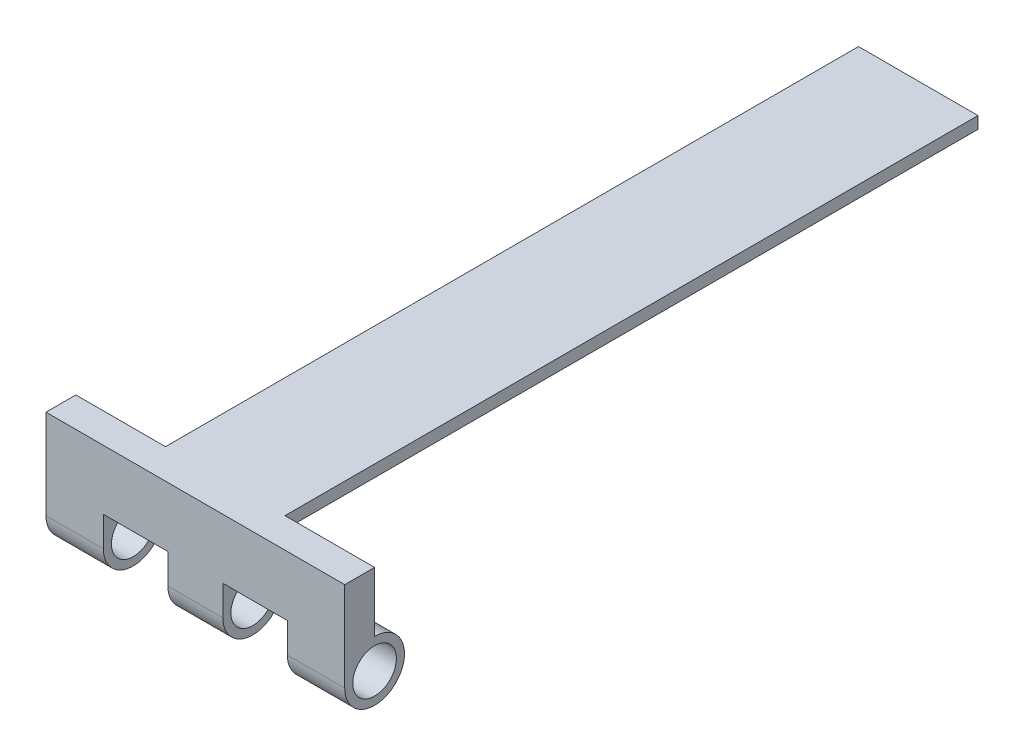
from build123d import *

# Parameters (mm, degrees)
SKETCH1_W               = 6.35
SKETCH1_H               = 19.05
BOSS_EXTRUDE1_DEPTH     = 31.75
SKETCH2_W               = 147.32
SKETCH2_H               = 2.54
EXTRUDE_THIN1_DEPTH     = 12.7
SKETCH3_R               = 6.35
SKETCH4_R               = 4.6355
CUT_EXTRUDE2_DEPTH      = 162.549790777
CUT_EXTRUDE4_DEPTH      = 159.067814244
CUT_EXTRUDE4_DEPTH_BACK = 159.067814244
SKETCH5_W               = 13.716
SKETCH5_H               = 12.7


with BuildPart() as part:
    # Sketch1 → Boss-Extrude1 (new, symmetric)
    with BuildSketch(Plane(origin=(0, 0, 0), x_dir=(0, 0, -1), z_dir=(1, 0, 0))):
        with Locations((-3.175, 9.525)):
            Rectangle(SKETCH1_W, SKETCH1_H)
    extrude(amount=BOSS_EXTRUDE1_DEPTH, both=True)

    # Sketch2 → Extrude-Thin1 (add, symmetric)
    with BuildSketch(Plane(origin=(0, 0, 0), x_dir=(0, 0, -1), z_dir=(1, 0, 0))):
        with Locations((73.66, 17.78)):
            Rectangle(SKETCH2_W, SKETCH2_H)
    extrude(amount=EXTRUDE_THIN1_DEPTH, both=True)

    # Sweep1: sweep along a curve in space
    with BuildLine() as sweep1_path:
        Line((31.75, 0, 0), (-31.75, 0, 0))
    # Sketch3 → Sweep1 (sweep)
    with BuildSketch(Plane(origin=(31.75, 0, 0), x_dir=(0, 0, -1), z_dir=(1, 0, 0))):
        Circle(SKETCH3_R)
    sweep(path=sweep1_path.line)

    # Sketch4 → Cut-Extrude2 (cut, through all)
    with BuildSketch(Plane(origin=(31.75, 0, 0), x_dir=(0, 0, -1), z_dir=(1, 0, 0))):
        Circle(SKETCH4_R)
    extrude(amount=-CUT_EXTRUDE2_DEPTH, mode=Mode.SUBTRACT)

    # Sketch5 → Cut-Extrude4 (cut, two sides: drawn at the far end of the back side and taken through both)
    with BuildSketch(Plane.XY.offset(6.35).offset(-CUT_EXTRUDE4_DEPTH_BACK)):
        with Locations((12.7, 0)):
            Rectangle(SKETCH5_W, SKETCH5_H)
        with Locations((-12.7, 0)):
            Rectangle(SKETCH5_W, SKETCH5_H)
    extrude(amount=CUT_EXTRUDE4_DEPTH + CUT_EXTRUDE4_DEPTH_BACK, mode=Mode.SUBTRACT)


solid = part.part
